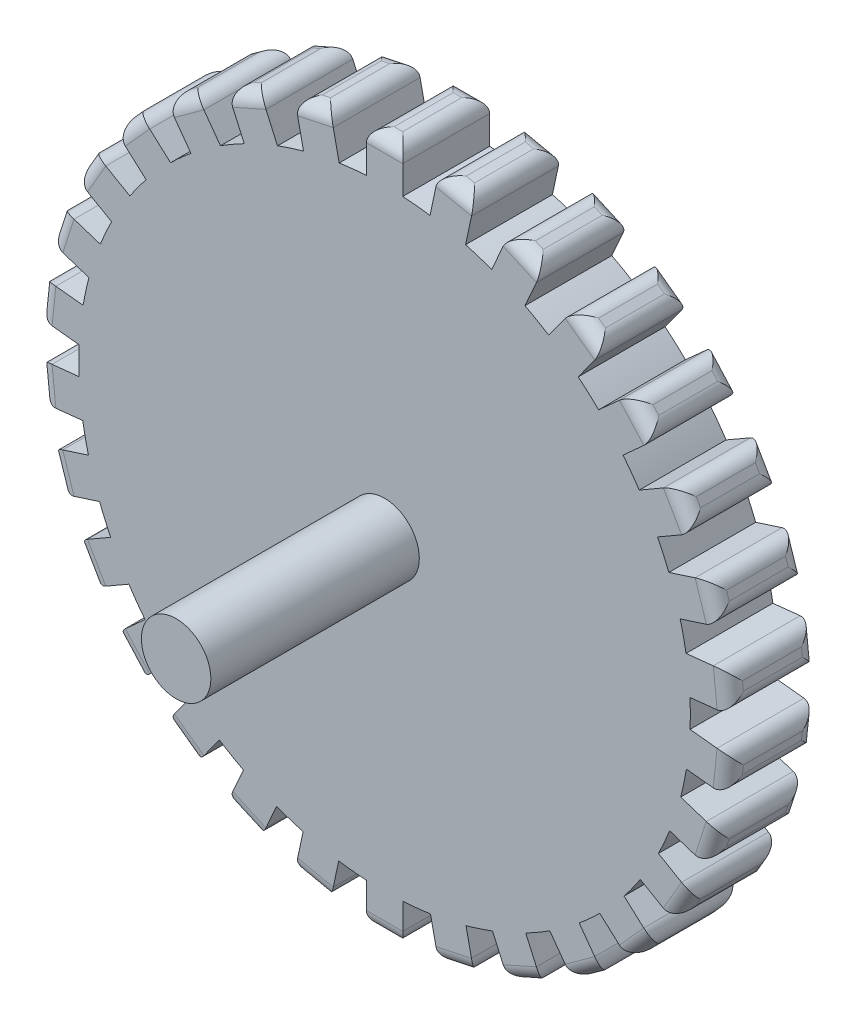
from build123d import *

# Parameters (mm, degrees)
SKETCH1_R                = 88
BOSS_EXTRUDE3_DEPTH      = 25
SKETCH4_W                = 10.4719
SKETCH4_H                = 13.351164338
BOSS_EXTRUDE4_DEPTH      = 25
FILLET2_R                = 4
CIRPATTERN1_COUNT        = 30
FILLET2_OF_CIRPATTERN1_R = 4
SKETCH6_R                = 10
BOSS_EXTRUDE5_DEPTH      = 60
BOSS_EXTRUDE6_START      = 10
SKETCH7_R                = 10
BOSS_EXTRUDE6_DEPTH      = 10


with BuildPart() as part:
    # Sketch1 → Boss-Extrude3 (new body)
    with BuildSketch(Plane.XY):
        Circle(SKETCH1_R)
    extrude(amount=BOSS_EXTRUDE3_DEPTH)

    # Sketch4 → Boss-Extrude4 (add)
    with BuildSketch(Plane.XY.offset(25)):
        with Locations((0, 93.324417831)):
            Rectangle(SKETCH4_W, SKETCH4_H)
    boss_extrude4 = extrude(amount=-BOSS_EXTRUDE4_DEPTH)

    # Fillet2
    fillet2_edges = [part.edges().sort_by_distance(p)[0] for p in [
        (5.23595, 100, 12.5),
        (0, 100, 0),
        (-5.23595, 100, 12.5),
        (0, 100, 25),
    ]]
    fillet(fillet2_edges, radius=FILLET2_R)

    # CirPattern1: Boss-Extrude4 ×30 about axis
    cirpattern1_axis = Axis((0, 0.317667884, 0), (0, 0, 1))
    for i in range(1, CIRPATTERN1_COUNT):
        add(boss_extrude4.rotate(cirpattern1_axis, i * 360 / CIRPATTERN1_COUNT))

    # Fillet2 of CirPattern1
    fillet2_of_cirpattern1_edges = [part.edges().sort_by_distance(p)[0] for p in [
        (-15.603590285, 98.910317096, 12.5),
        (-20.725122215, 97.821701879, 0),
        (-25.846654145, 96.733086661, 12.5),
        (-20.725122215, 97.821701879, 25),
        (-35.7611788, 93.511662322, 12.5),
        (-40.544457139, 91.382009596, 0),
        (-45.327735478, 89.252356869, 12.5),
        (-40.544457139, 91.382009596, 25),
        (-54.3558322, 84.039982796, 12.5),
        (-58.591804732, 80.962368605, 0),
        (-62.827777264, 77.884754413, 12.5),
        (-58.591804732, 80.962368605, 25),
        (-70.574874905, 70.909236365, 12.5),
        (-74.078409304, 67.018167216, 0),
        (-77.581943702, 63.127098067, 12.5),
        (-74.078409304, 67.018167216, 25),
        (-83.709456921, 54.693299655, 12.5),
        (-86.327431921, 50.158833942, 0),
        (-88.945406921, 45.624368229, 12.5),
        (-86.327431921, 50.158833942, 25),
        (-93.185533987, 36.100886913, 12.5),
        (-94.803531519, 31.121202547, 0),
        (-96.42152905, 26.14151818, 12.5),
        (-94.803531519, 31.121202547, 25),
        (-98.588956064, 15.944575793, 12.5),
        (-99.136261871, 10.737308875, 0),
        (-99.683567678, 5.530041957, 12.5),
        (-99.136261871, 10.737308875, 25),
        (-99.683567678, -4.894706189, 12.5),
        (-99.136261871, -10.101973107, 0),
        (-98.588956064, -15.309240025, 12.5),
        (-99.136261871, -10.101973107, 25),
        (-96.42152905, -25.506182413, 12.5),
        (-94.803531519, -30.485866779, 0),
        (-93.185533987, -35.465551145, 12.5),
        (-94.803531519, -30.485866779, 25),
        (-88.945406921, -44.989032461, 12.5),
        (-86.327431921, -49.523498174, 0),
        (-83.709456921, -54.057963887, 12.5),
        (-86.327431921, -49.523498174, 25),
        (-77.581943702, -62.491762299, 12.5),
        (-74.078409304, -66.382831448, 0),
        (-70.574874905, -70.273900597, 12.5),
        (-74.078409304, -66.382831448, 25),
        (-62.827777264, -77.249418645, 12.5),
        (-58.591804732, -80.327032837, 0),
        (-54.3558322, -83.404647029, 12.5),
        (-58.591804732, -80.327032837, 25),
        (-45.327735478, -88.617021102, 12.5),
        (-40.544457139, -90.746673828, 0),
        (-35.7611788, -92.876326554, 12.5),
        (-40.544457139, -90.746673828, 25),
        (-25.846654145, -96.097750894, 12.5),
        (-20.725122215, -97.186366111, 0),
        (-15.603590285, -98.274981329, 12.5),
        (-20.725122215, -97.186366111, 25),
        (-5.23595, -99.364664232, 12.5),
        (0, -99.364664232, 0),
        (5.23595, -99.364664232, 12.5),
        (0, -99.364664232, 25),
        (15.603590285, -98.274981329, 12.5),
        (20.725122215, -97.186366111, 0),
        (25.846654145, -96.097750894, 12.5),
        (20.725122215, -97.186366111, 25),
        (35.7611788, -92.876326554, 12.5),
        (40.544457139, -90.746673828, 0),
        (45.327735478, -88.617021102, 12.5),
        (40.544457139, -90.746673828, 25),
        (54.3558322, -83.404647029, 12.5),
        (58.591804732, -80.327032837, 0),
        (62.827777264, -77.249418645, 12.5),
        (58.591804732, -80.327032837, 25),
        (70.574874905, -70.273900597, 12.5),
        (74.078409304, -66.382831448, 0),
        (77.581943702, -62.491762299, 12.5),
        (74.078409304, -66.382831448, 25),
        (83.709456921, -54.057963887, 12.5),
        (86.327431921, -49.523498174, 0),
        (88.945406921, -44.989032461, 12.5),
        (86.327431921, -49.523498174, 25),
        (93.185533987, -35.465551145, 12.5),
        (94.803531519, -30.485866779, 0),
        (96.42152905, -25.506182413, 12.5),
        (94.803531519, -30.485866779, 25),
        (98.588956064, -15.309240025, 12.5),
        (99.136261871, -10.101973107, 0),
        (99.683567678, -4.894706189, 12.5),
        (99.136261871, -10.101973107, 25),
        (99.683567678, 5.530041957, 12.5),
        (99.136261871, 10.737308875, 0),
        (98.588956064, 15.944575793, 12.5),
        (99.136261871, 10.737308875, 25),
        (96.42152905, 26.14151818, 12.5),
        (94.803531519, 31.121202547, 0),
        (93.185533987, 36.100886913, 12.5),
        (94.803531519, 31.121202547, 25),
        (88.945406921, 45.624368229, 12.5),
        (86.327431921, 50.158833942, 0),
        (83.709456921, 54.693299655, 12.5),
        (86.327431921, 50.158833942, 25),
        (77.581943702, 63.127098067, 12.5),
        (74.078409304, 67.018167216, 0),
        (70.574874905, 70.909236365, 12.5),
        (74.078409304, 67.018167216, 25),
        (62.827777264, 77.884754413, 12.5),
        (58.591804732, 80.962368605, 0),
        (54.3558322, 84.039982796, 12.5),
        (58.591804732, 80.962368605, 25),
        (45.327735478, 89.252356869, 12.5),
        (40.544457139, 91.382009596, 0),
        (35.7611788, 93.511662322, 12.5),
        (40.544457139, 91.382009596, 25),
        (25.846654145, 96.733086661, 12.5),
        (20.725122215, 97.821701879, 0),
        (15.603590285, 98.910317096, 12.5),
        (20.725122215, 97.821701879, 25),
    ]]
    fillet(fillet2_of_cirpattern1_edges, radius=FILLET2_OF_CIRPATTERN1_R)

    # Sketch6 → Boss-Extrude5 (add)
    with BuildSketch(Plane.XY.offset(25)):
        Circle(SKETCH6_R)
    extrude(amount=BOSS_EXTRUDE5_DEPTH)

    # Sketch7 → Boss-Extrude6 (add)
    with BuildSketch(Plane(origin=(0, 0, 0), x_dir=(-1, 0, 0), z_dir=(0, 0, -1)).offset(BOSS_EXTRUDE6_START)):
        with Locations(Location((0, 0, 0), (0, 0, 180))):
            Circle(SKETCH7_R)
    extrude(amount=-BOSS_EXTRUDE6_DEPTH)


solid = part.part
